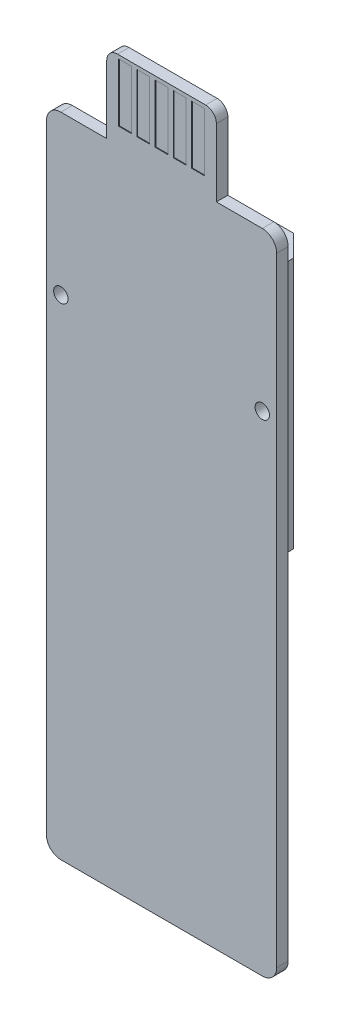
from build123d import *

# Parameters (mm, degrees)
SKETCH_1_R          = 1
EXTRUDE_1_DEPTH     = 1.6
SKETCH_2_R          = 1
CUT_EXTRUDE_1_DEPTH = 1.6
EXTRUDE_START       = 1.6
EXTRUDE_2_DEPTH     = 1.6
SKETCH_4_W          = 1.78
SKETCH_4_H          = 8.1
CUT_EXTRUDE_2_DEPTH = 0.1
CUT_EXTRUDE_START   = 1.6
SKETCH_5_W          = 1.78
SKETCH_5_H          = 8.1
CUT_EXTRUDE_3_DEPTH = 0.1
SKETCH_6_W          = 19.5
SKETCH_6_H          = 70
EXTRUDE_3_DEPTH     = 10
CUT_EXTRUDE_START_2 = 40
CUT_EXTRUDE_4_DEPTH = 70
CUT_EXTRUDE_START_3 = -10
SKETCH_9_W          = 19.5
SKETCH_9_H          = 35
CUT_EXTRUDE_5_DEPTH = 4
CUT_EXTRUDE_6_DEPTH = 1.6


with BuildPart() as part:
    # 草图1 → 凸台-拉伸1 (new body)
    with BuildSketch(Plane.XY):
        with BuildLine():
            Line((-14, 50), (14, 50))
            ThreePointArc((14, 50), (15.414213562, 49.414213562), (16, 48))
            Line((16, 48), (16, -48))
            ThreePointArc((16, -48), (15.414213562, -49.414213562), (14, -50))
            Line((14, -50), (-14, -50))
            ThreePointArc((-14, -50), (-15.414213562, -49.414213562), (-16, -48))
            Line((-16, -48), (-16, 48))
            ThreePointArc((-16, 48), (-15.414213562, 49.414213562), (-14, 50))
        make_face()
        with Locations((-14, -48)):
            Circle(SKETCH_1_R, mode=Mode.SUBTRACT)
        with Locations((14, -48)):
            Circle(SKETCH_1_R, mode=Mode.SUBTRACT)
    extrude(amount=EXTRUDE_1_DEPTH)

    # 草图2 → 切除-拉伸1 (cut)
    with BuildSketch(Plane.XY):
        with Locations((-14, 28)):
            Circle(SKETCH_2_R)
        with Locations((14, 28)):
            Circle(SKETCH_2_R)
    extrude(amount=CUT_EXTRUDE_1_DEPTH, mode=Mode.SUBTRACT)

    # 草图3 → 凸台-拉伸2 (add)
    with BuildSketch(Plane.XY.offset(EXTRUDE_START)):
        with BuildLine():
            Line((-7.62, 50), (7.62, 50))
            Line((7.62, 50), (7.62, 59.42))
            ThreePointArc((7.62, 59.42), (7.180660172, 60.480660172), (6.12, 60.92))
            Line((6.12, 60.92), (-6.12, 60.92))
            ThreePointArc((-6.12, 60.92), (-7.180660172, 60.480660172), (-7.62, 59.42))
            Line((-7.62, 59.42), (-7.62, 50))
        make_face()
        with BuildLine():
            Line((-7.62, -59.42), (-7.62, -50))
            Line((-7.62, -50), (7.62, -50))
            Line((7.62, -50), (7.62, -59.42))
            ThreePointArc((7.62, -59.42), (7.180660172, -60.480660172), (6.12, -60.92))
            Line((6.12, -60.92), (-6.12, -60.92))
            ThreePointArc((-6.12, -60.92), (-7.180660172, -60.480660172), (-7.62, -59.42))
        make_face()
    extrude(amount=-EXTRUDE_2_DEPTH)

    # 草图4 → 切除-拉伸2 (cut)
    with BuildSketch(Plane.XY):
        with Locations((0, 56.37)):
            Rectangle(SKETCH_4_W, SKETCH_4_H)
        with Locations((2.54, 56.37)):
            Rectangle(SKETCH_4_W, SKETCH_4_H)
        with Locations((5.08, 56.37)):
            Rectangle(SKETCH_4_W, SKETCH_4_H)
        with Locations((-2.54, 56.37)):
            Rectangle(SKETCH_4_W, SKETCH_4_H)
        with Locations((-5.08, 56.37)):
            Rectangle(SKETCH_4_W, SKETCH_4_H)
        with Locations((-5.08, -56.37)):
            Rectangle(SKETCH_4_W, SKETCH_4_H)
        with Locations((-2.54, -56.37)):
            Rectangle(SKETCH_4_W, SKETCH_4_H)
        with Locations((5.08, -56.37)):
            Rectangle(SKETCH_4_W, SKETCH_4_H)
        with Locations((2.54, -56.37)):
            Rectangle(SKETCH_4_W, SKETCH_4_H)
        with Locations((0, -56.37)):
            Rectangle(SKETCH_4_W, SKETCH_4_H)
    extrude(amount=CUT_EXTRUDE_2_DEPTH, mode=Mode.SUBTRACT)

    # 草图5 → 切除-拉伸3 (cut)
    with BuildSketch(Plane.XY.offset(CUT_EXTRUDE_START)):
        with Locations((2.54, 56.37)):
            Rectangle(SKETCH_5_W, SKETCH_5_H)
        with Locations((0, 56.37)):
            Rectangle(SKETCH_5_W, SKETCH_5_H)
        with Locations((-5.08, 56.37)):
            Rectangle(SKETCH_5_W, SKETCH_5_H)
        with Locations((-2.54, 56.37)):
            Rectangle(SKETCH_5_W, SKETCH_5_H)
        with Locations((5.08, 56.37)):
            Rectangle(SKETCH_5_W, SKETCH_5_H)
        with Locations((2.54, -56.37)):
            Rectangle(SKETCH_5_W, SKETCH_5_H)
        with Locations((5.08, -56.37)):
            Rectangle(SKETCH_5_W, SKETCH_5_H)
        with Locations((-2.54, -56.37)):
            Rectangle(SKETCH_5_W, SKETCH_5_H)
        with Locations((-5.08, -56.37)):
            Rectangle(SKETCH_5_W, SKETCH_5_H)
        with Locations((0, -56.37)):
            Rectangle(SKETCH_5_W, SKETCH_5_H)
    extrude(amount=-CUT_EXTRUDE_3_DEPTH, mode=Mode.SUBTRACT)

    # 草图6 → 凸台-拉伸3 (add)
    with BuildSketch(Plane.XY):
        with Locations((0, 5)):
            Rectangle(SKETCH_6_W, SKETCH_6_H)
    extrude(amount=-EXTRUDE_3_DEPTH)

    # 草图7 → 切除-拉伸4 (cut)
    with BuildSketch(Plane(origin=(0, 0, 0), x_dir=(1, 0, 0), z_dir=(0, 1, 0)).offset(CUT_EXTRUDE_START_2)):
        Polygon((9.75, 10), (9.75, 7), (6.75, 10), align=None)
        Polygon((-9.75, 10), (-6.75, 10), (-9.75, 7), align=None)
    extrude(amount=-CUT_EXTRUDE_4_DEPTH, mode=Mode.SUBTRACT)

    # 草图9 → 切除-拉伸5 (cut)
    with BuildSketch(Plane.XY.offset(CUT_EXTRUDE_START_3)):
        with Locations((0, -12.5)):
            Rectangle(SKETCH_9_W, SKETCH_9_H)
    extrude(amount=CUT_EXTRUDE_5_DEPTH, mode=Mode.SUBTRACT)

    # 草图11 → 切除-拉伸6 (cut)
    with BuildSketch(Plane.XY):
        with BuildLine():
            Line((7.62, -50), (14, -50))
            ThreePointArc((14, -50), (15.414213562, -49.414213562), (16, -48))
            Line((16, -48), (16, -38))
            ThreePointArc((16, -38), (15.414213562, -39.414213562), (14, -40))
            Line((14, -40), (-14, -40))
            ThreePointArc((-14, -40), (-15.414213562, -39.414213562), (-16, -38))
            Line((-16, -38), (-16, -48))
            ThreePointArc((-16, -48), (-15.414213562, -49.414213562), (-14, -50))
            Line((-14, -50), (-7.62, -50))
            Line((-7.62, -50), (-7.62, -59.42))
            ThreePointArc((-7.62, -59.42), (-7.180660172, -60.480660172), (-6.12, -60.92))
            Line((-6.12, -60.92), (6.12, -60.92))
            ThreePointArc((6.12, -60.92), (7.180660172, -60.480660172), (7.62, -59.42))
            Line((7.62, -59.42), (7.62, -50))
        make_face()
    extrude(amount=CUT_EXTRUDE_6_DEPTH, mode=Mode.SUBTRACT)


solid = part.part
